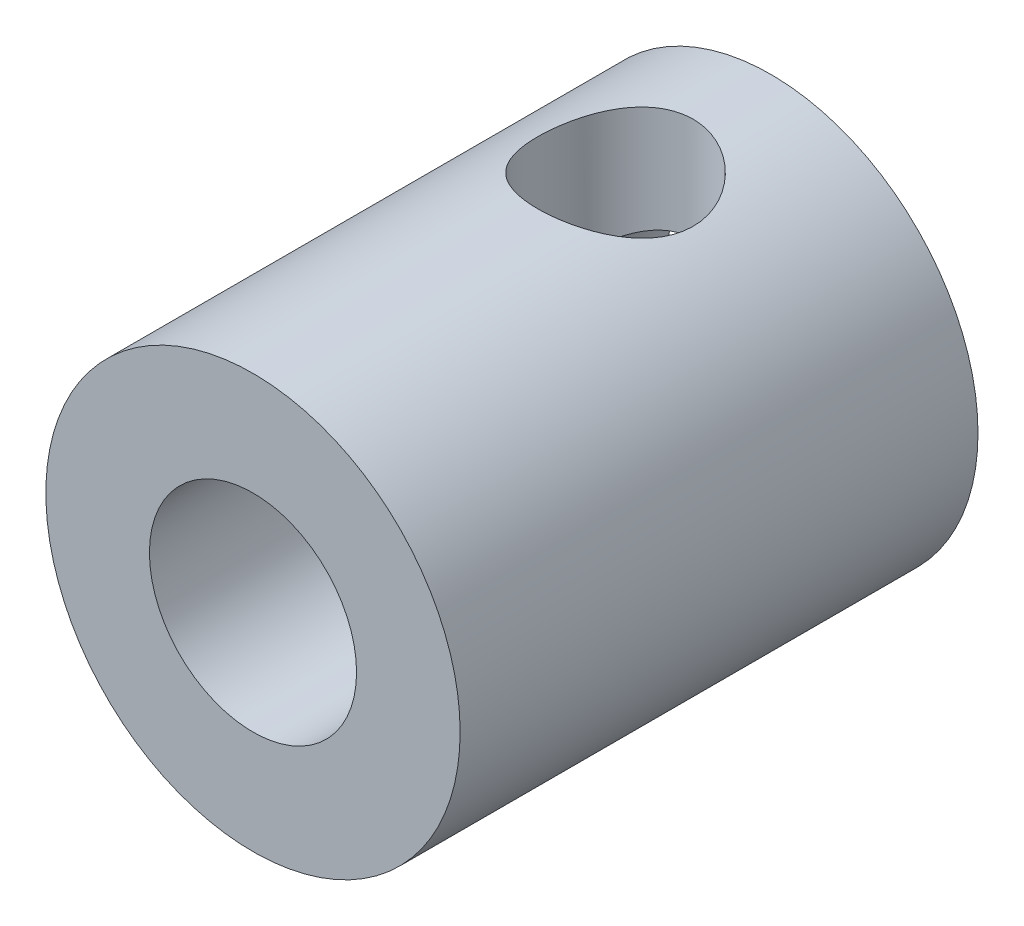
from build123d import *

# Parameters (mm, degrees)
SKETCH_1_R          = 20
SKETCH_1_R_2        = 10
EXTRUDE_1_DEPTH     = 50
SKETCH_2_R          = 7.5
CUT_EXTRUDE_1_DEPTH = 30


with BuildPart() as part:
    # 草图1 → 凸台-拉伸1 (new body)
    with BuildSketch(Plane.XY):
        Circle(SKETCH_1_R)
        Circle(SKETCH_1_R_2, mode=Mode.SUBTRACT)
    extrude(amount=EXTRUDE_1_DEPTH)

    # 草图2 → 切除-拉伸1 (cut)
    with BuildSketch(Plane(origin=(0, 0, 0), x_dir=(1, 0, 0), z_dir=(0, 1, 0))):
        with Locations(Location((0, -15, 0), (0, 0, 90))):
            Circle(SKETCH_2_R)
    extrude(amount=CUT_EXTRUDE_1_DEPTH, mode=Mode.SUBTRACT)


solid = part.part
